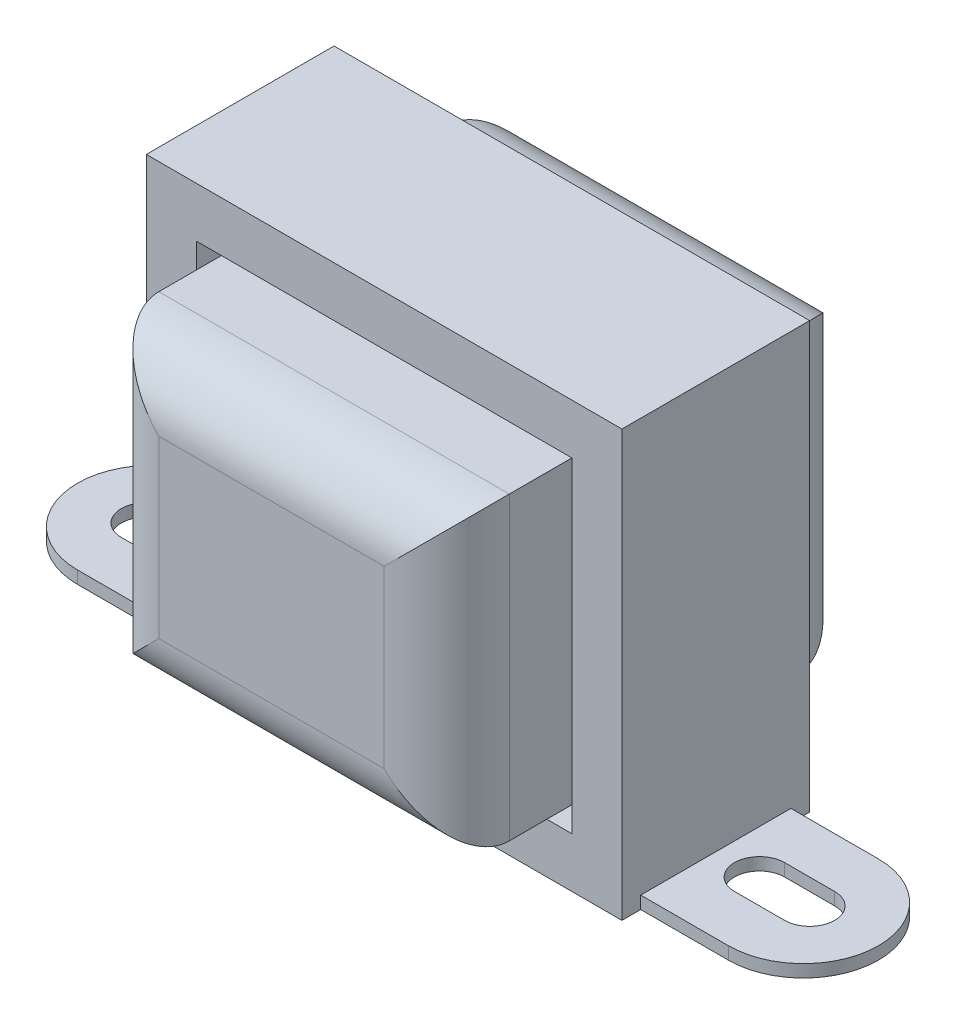
from build123d import *

# Parameters (mm, degrees)
SKETCH1_W           = 38
SKETCH1_H           = 34
BOSS_EXTRUDE1_DEPTH = 7.5
BOSS_EXTRUDE2_DEPTH = 1
CUT_EXTRUDE1_REACH  = 48.575
CUT_EXTRUDE2_REACH  = 41.217
SKETCH4_W           = 30
SKETCH4_H           = 26
SKETCH5_W           = 28
SKETCH5_H           = 24
BOSS_EXTRUDE3_DEPTH = 16.5
FILLET1_R           = 5


with BuildPart() as part:
    # Sketch1 → Boss-Extrude1 (new, symmetric)
    with BuildSketch(Plane.XY):
        Rectangle(SKETCH1_W, SKETCH1_H)
    extrude(amount=BOSS_EXTRUDE1_DEPTH, both=True)

    # Sketch2 → Boss-Extrude2 (add)
    with BuildSketch(Plane.XZ.offset(17)):
        with BuildLine():
            Line((19, 6), (19, -6))
            Line((19, -6), (26, -6))
            ThreePointArc((26, -6), (32, 0), (26, 6))
            Line((26, 6), (19, 6))
        make_face()
        with BuildLine():
            Line((-26, -6), (-19, -6))
            Line((-19, -6), (-19, 6))
            Line((-19, 6), (-26, 6))
            ThreePointArc((-26, 6), (-32, 0), (-26, -6))
        make_face()
    extrude(amount=-BOSS_EXTRUDE2_DEPTH)

    # Sketch3 → Cut-Extrude1 (cut, up to next)
    with BuildSketch(Plane(origin=(0, -16, 0), x_dir=(1, 0, 0), z_dir=(0, 1, 0)), mode=Mode.PRIVATE) as cut_extrude1_sk1:
        with BuildLine():
            Line((-22.495625059, -2), (-26.495625059, -2))
            ThreePointArc((-26.495625059, -2), (-28.495625059, 0), (-26.495625059, 2))
            Line((-26.495625059, 2), (-22.495625059, 2))
            ThreePointArc((-22.495625059, 2), (-20.495625059, 0), (-22.495625059, -2))
        make_face()
    cut_extrude1_tool1 = extrude(cut_extrude1_sk1.sketch, amount=-CUT_EXTRUDE1_REACH, mode=Mode.PRIVATE) & part.part
    # Sketch3 → Cut-Extrude1 (cut, up to next)
    with BuildSketch(Plane(origin=(0, -16, 0), x_dir=(1, 0, 0), z_dir=(0, 1, 0)), mode=Mode.PRIVATE) as cut_extrude1_sk2:
        with BuildLine():
            Line((22.495625059, -2), (26.495625059, -2))
            ThreePointArc((26.495625059, -2), (28.495625059, 0), (26.495625059, 2))
            Line((26.495625059, 2), (22.495625059, 2))
            ThreePointArc((22.495625059, 2), (20.495625059, 0), (22.495625059, -2))
        make_face()
    cut_extrude1_tool2 = extrude(cut_extrude1_sk2.sketch, amount=-CUT_EXTRUDE1_REACH, mode=Mode.PRIVATE) & part.part
    add(cut_extrude1_tool1.solids().sort_by_distance((-24.495625, -16, 0))[0], mode=Mode.SUBTRACT)
    add(cut_extrude1_tool2.solids().sort_by_distance((24.495625, -16, 0))[0], mode=Mode.SUBTRACT)

    # Sketch4 → Cut-Extrude2 (cut, up to next)
    with BuildSketch(Plane(origin=(0, 0, -7.5), x_dir=(-1, 0, 0), z_dir=(0, 0, -1)), mode=Mode.PRIVATE) as cut_extrude2_sk1:
        Rectangle(SKETCH4_W, SKETCH4_H)
    cut_extrude2_tool1 = extrude(cut_extrude2_sk1.sketch, amount=-CUT_EXTRUDE2_REACH, mode=Mode.PRIVATE) & part.part
    add(cut_extrude2_tool1.solids().sort_by_distance((0, 0, -7.5))[0], mode=Mode.SUBTRACT)


with BuildPart() as body_2:
    # Sketch5 → Boss-Extrude3 (new, symmetric)
    with BuildSketch(Plane.XY):
        Rectangle(SKETCH5_W, SKETCH5_H)
    extrude(amount=BOSS_EXTRUDE3_DEPTH, both=True)

    # Fillet1
    fillet1_edges = [body_2.edges().sort_by_distance(p)[0] for p in [
        (-14, 0, 16.5),
        (0, -12, 16.5),
        (14, 0, 16.5),
        (0, -12, -16.5),
        (-14, 0, -16.5),
        (0, 12, -16.5),
        (14, 0, -16.5),
        (0, 12, 16.5),
    ]]
    fillet(fillet1_edges, radius=FILLET1_R)


solid = Compound([part.part, body_2.part])
